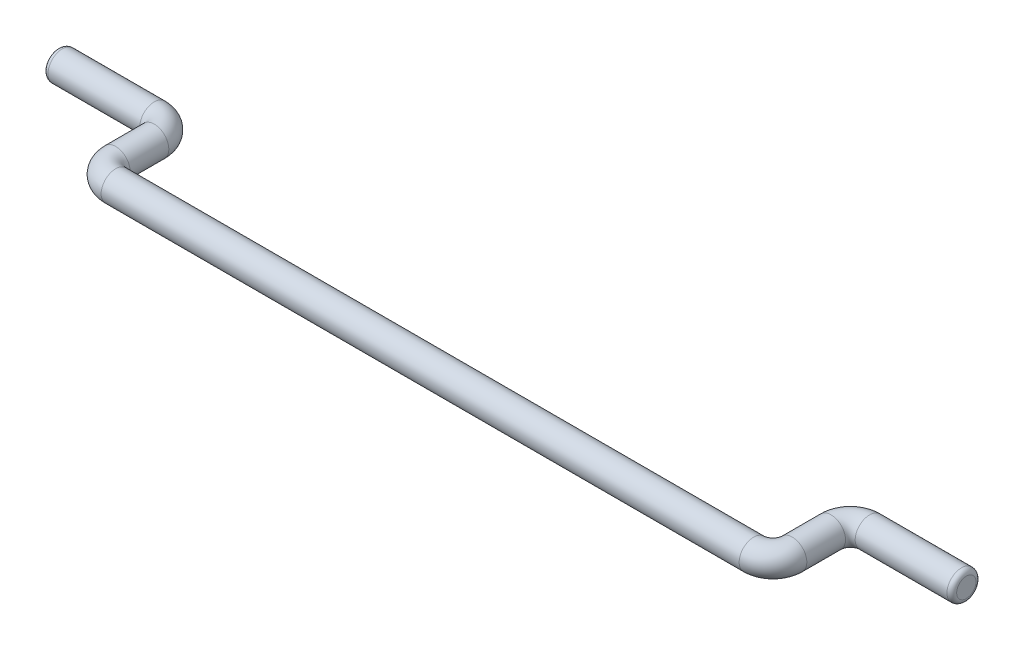
from build123d import *

# Parameters (mm, degrees)
SKETCH3_R = 0.75
FILLET1_R = 0.25


with BuildPart() as part:
    # Sweep1: sweep along a path in Sketch1
    with BuildLine(Plane(origin=(0, 0, 0), x_dir=(1, 0, 0), z_dir=(0, 1, 0))) as sweep1_path:
        Line((-6, 0), (-1, 0))
        ThreePointArc((-1, 0), (-0.292893219, -0.292893219), (0, -1))
        Line((0, -1), (0, -3))
        ThreePointArc((0, -3), (0.292893219, -3.707106781), (1, -4))
        Line((1, -4), (34, -4))
        ThreePointArc((34, -4), (34.707106781, -3.707106781), (35, -3))
        Line((35, -3), (35, -1))
        ThreePointArc((35, -1), (35.292893219, -0.292893219), (36, 0))
        Line((36, 0), (41, 0))
    # Sketch3 → Sweep1 (sweep)
    with BuildSketch(Plane(origin=(-6, 0, 0), x_dir=(0, 0, -1), z_dir=(1, 0, 0))):
        Circle(SKETCH3_R)
    sweep(path=sweep1_path.line)

    # Fillet1
    fillet1_edges = [part.edges().sort_by_distance(p)[0] for p in [
        (41, 0, 0.75),
        (-6, 0, 0.75),
    ]]
    fillet(fillet1_edges, radius=FILLET1_R)


solid = part.part
